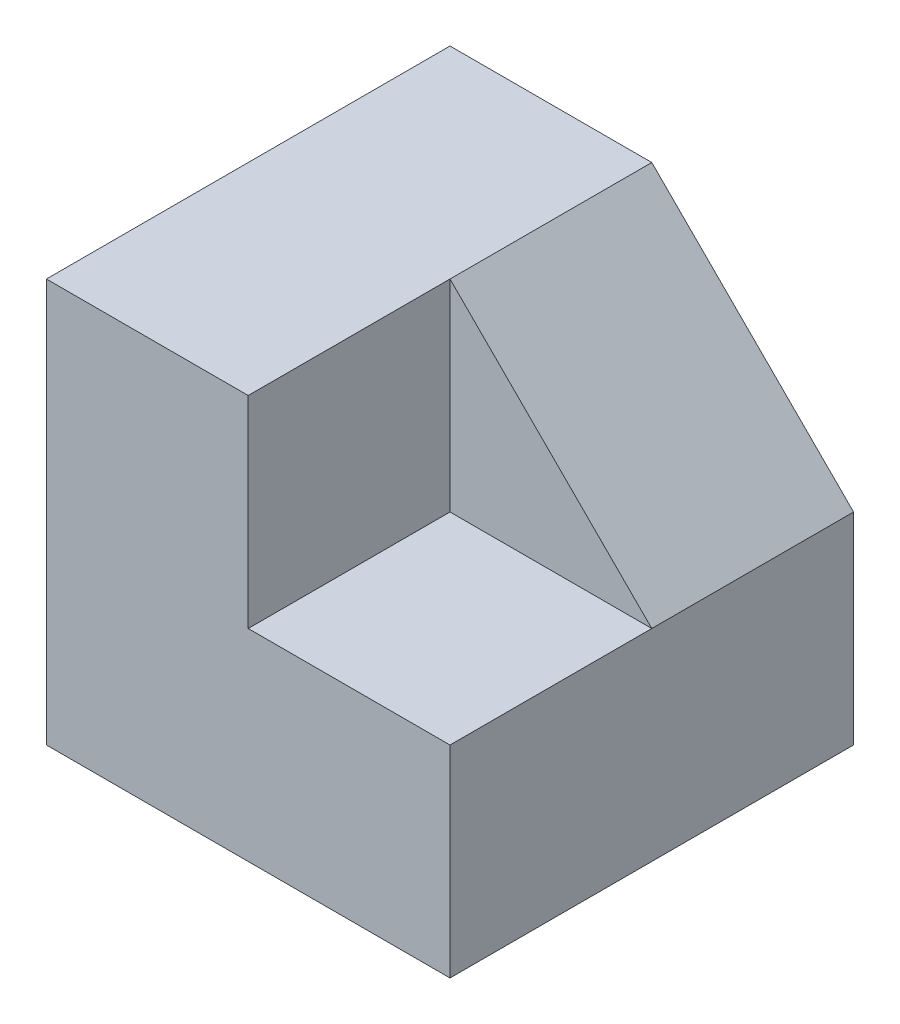
from build123d import *

# Parameters (mm, degrees)
CROQUIS1_W              = 60
CROQUIS1_H              = 60
SALIENTE_EXTRUIR1_DEPTH = 60
CROQUIS2_W              = 30
CROQUIS2_H              = 30
CORTAR_EXTRUIR1_DEPTH   = 30
CORTAR_EXTRUIR2_DEPTH   = 30


with BuildPart() as part:
    # Croquis1 → Saliente-Extruir1 (new body)
    with BuildSketch(Plane.XY):
        with Locations((30, 30)):
            Rectangle(CROQUIS1_W, CROQUIS1_H)
    extrude(amount=-SALIENTE_EXTRUIR1_DEPTH)

    # Croquis2 → Cortar-Extruir1 (cut)
    with BuildSketch(Plane(origin=(0, 60, 0), x_dir=(1, 0, 0), z_dir=(0, 1, 0))):
        with Locations((45, 15)):
            Rectangle(CROQUIS2_W, CROQUIS2_H)
    extrude(amount=-CORTAR_EXTRUIR1_DEPTH, mode=Mode.SUBTRACT)

    # Croquis3 → Cortar-Extruir2 (cut)
    with BuildSketch(Plane.XY.offset(-30)):
        Polygon((60, 30), (30, 60), (60, 60), align=None)
    extrude(amount=-CORTAR_EXTRUIR2_DEPTH, mode=Mode.SUBTRACT)


solid = part.part
